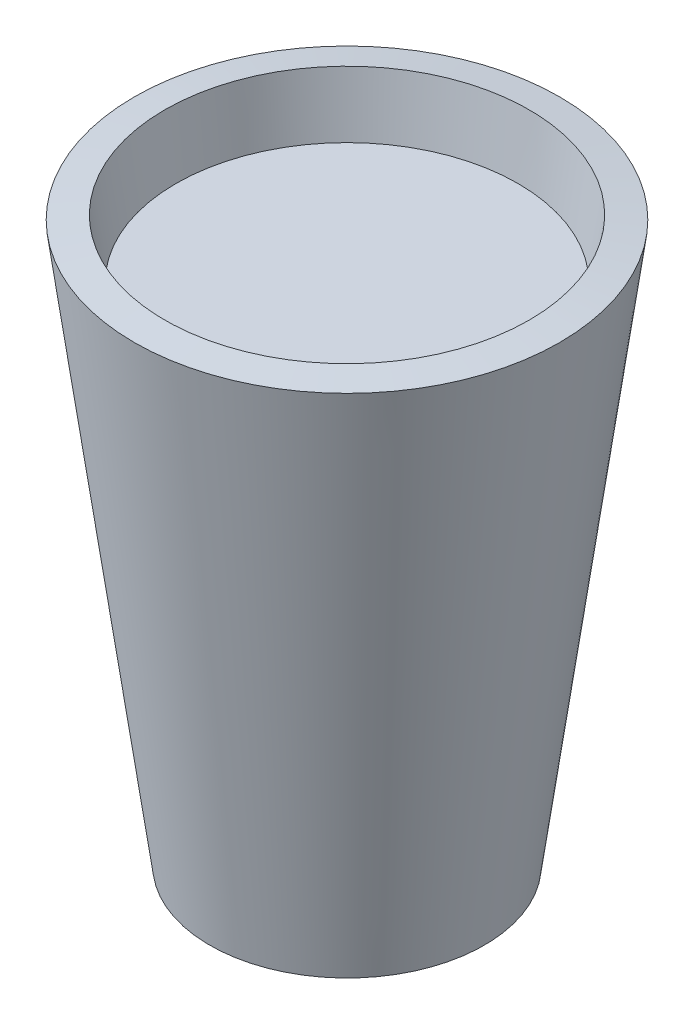
from build123d import *

# Parameters (mm, degrees)
SKETCH2_R           = 22.225
BOSS_EXTRUDE1_DEPTH = 94.996
BOSS_EXTRUDE1_DRAFT = -8


with BuildPart() as part:
    # Sketch1 → Revolve4 (revolve)
    with BuildSketch(Plane.XY, mode=Mode.PRIVATE) as revolve4_sk:
        Polygon((0, 0), (28.575, 0), (44.252547846, 116.424181846), (37.902547846, 117.27926562), (22.225, 10.16), (0, 10.16), align=None)
    revolve(revolve4_sk.sketch.rotate(Axis((0, 10.16, 0), (0, -1, 0)), 180), axis=Axis((0, 10.16, 0), (0, -1, 0)))


with BuildPart() as boss_extrude1_tool:
    # Sketch2 → Boss-Extrude1 (with draft: the straight prism first)
    with BuildSketch(Plane(origin=(0, 10.16, 0), x_dir=(1, 0, 0), z_dir=(0, 1, 0))):
        Circle(SKETCH2_R)
    extrude(amount=BOSS_EXTRUDE1_DEPTH)
    # Boss-Extrude1: the draft: its side faces are tilted about the plane it starts from
    boss_extrude1_sides = [boss_extrude1_tool.faces().sort_by_distance(p)[0] for p in [
        (-22.225, 57.658, 0),
    ]]
    draft(boss_extrude1_sides, Plane(origin=(0, 10.16, 0), x_dir=(1, 0, 0), z_dir=(0, 1, 0)), BOSS_EXTRUDE1_DRAFT)


with BuildPart() as part_1:
    add(part.part)

    # Boss-Extrude1: add boss_extrude1_tool
    add(boss_extrude1_tool.part)


solid = part_1.part
